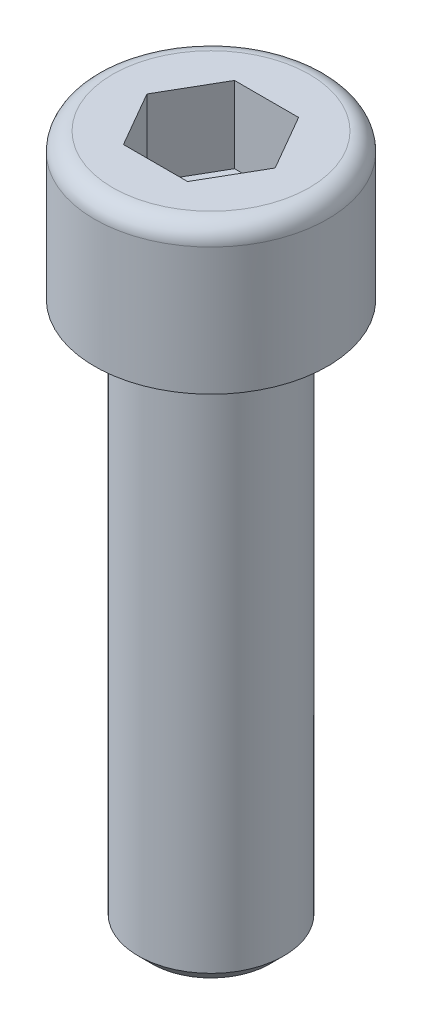
from build123d import *

# Parameters (mm, degrees)
ESQUISSE1_W             = 6.4
ESQUISSE1_H             = 8
ESQUISSE2_R             = 4
BOSS_EXTRU_1_DEPTH      = 30
ENL_V_MAT_EXTRU_1_DEPTH = 4.2
CHANFREIN1_SIZE         = 0.75
CONG_1_R                = 1


with BuildPart() as part:
    # Esquisse1 → Révolution1 (revolve)
    with BuildSketch(Plane.XY, mode=Mode.PRIVATE) as r_volution1_sk:
        with Locations((3.2, 4)):
            Rectangle(ESQUISSE1_W, ESQUISSE1_H)
    revolve(r_volution1_sk.sketch.rotate(Axis((0, 8, 0), (0, -1, 0)), 270), axis=Axis((0, 8, 0), (0, -1, 0)))

    # Esquisse2 → Boss.-Extru.1 (add)
    with BuildSketch(Plane.XZ):
        with Locations(Location((0, 0, 0), (0, 0, 270))):
            Circle(ESQUISSE2_R)
    extrude(amount=BOSS_EXTRU_1_DEPTH)

    # Esquisse3 → Enlèv. mat.-Extru.1 (cut)
    with BuildSketch(Plane(origin=(0, 8, 0), x_dir=(-1, 0, 0), z_dir=(0, 1, 0))):
        Polygon((1.760918321, 3.05), (-1.760918321, 3.05), (-3.521836642, 0), (-1.760918321, -3.05), (1.760918321, -3.05), (3.521836642, 0), align=None)
    extrude(amount=-ENL_V_MAT_EXTRU_1_DEPTH, mode=Mode.SUBTRACT)

    # Chanfrein1
    chanfrein1_edges = [part.edges().sort_by_distance(p)[0] for p in [
        (0, -30, 4),
    ]]
    chamfer(chanfrein1_edges, length=CHANFREIN1_SIZE)

    # Congé1
    cong_1_edges = [part.edges().sort_by_distance(p)[0] for p in [
        (0, 8, 6.4),
    ]]
    fillet(cong_1_edges, radius=CONG_1_R)


solid = part.part
